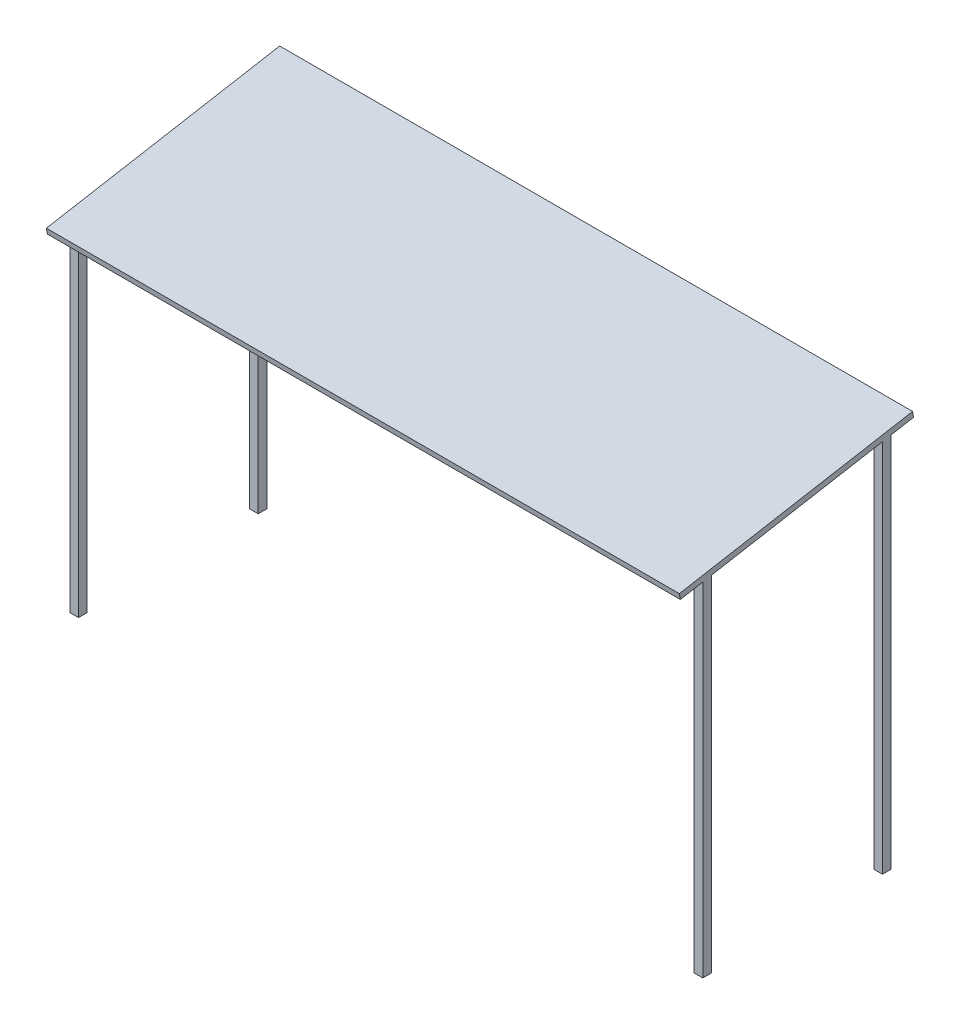
from build123d import *

# Parameters (mm, degrees)
CROQUIS1_W                = 76.2
CROQUIS1_H                = 76.2
SALIENTE_EXTRUIR1_DEPTH   = 3300
SALIENTE_EXTRUIR1_2_DEPTH = 3300
SALIENTE_EXTRUIR1_3_DEPTH = 3300
SALIENTE_EXTRUIR1_4_DEPTH = 3300
CORTAR_EXTRUIR3_START     = -5552.4
CORTAR_EXTRUIR3_DEPTH     = 5552.4
SALIENTE_EXTRUIR3_DEPTH   = 5552.4
CROQUIS7_W                = 5400
CROQUIS7_H                = 76.2
SALIENTE_EXTRUIR4_DEPTH   = 76.2
SALIENTE_EXTRUIR6_DEPTH   = 5400


with BuildPart() as part:
    # Croquis1 → Saliente-Extruir1 (new body)
    with BuildSketch(Plane(origin=(0, 0, 0), x_dir=(1, 0, 0), z_dir=(0, 1, 0))):
        with Locations((38.1, -38.1)):
            Rectangle(CROQUIS1_W, CROQUIS1_H)
    extrude(amount=SALIENTE_EXTRUIR1_DEPTH)


with BuildPart() as body_2:
    # Croquis1 → Saliente-Extruir1 2 (new body)
    with BuildSketch(Plane(origin=(0, 0, 0), x_dir=(1, 0, 0), z_dir=(0, 1, 0))):
        with Locations((5514.3, -38.1)):
            Rectangle(CROQUIS1_W, CROQUIS1_H)
    extrude(amount=SALIENTE_EXTRUIR1_2_DEPTH)


with BuildPart() as body_3:
    # Croquis1 → Saliente-Extruir1 3 (new body)
    with BuildSketch(Plane(origin=(0, 0, 0), x_dir=(1, 0, 0), z_dir=(0, 1, 0))):
        with Locations((5514.3, -1614.3)):
            Rectangle(CROQUIS1_W, CROQUIS1_H)
    extrude(amount=SALIENTE_EXTRUIR1_3_DEPTH)


with BuildPart() as body_4:
    # Croquis1 → Saliente-Extruir1 4 (new body)
    with BuildSketch(Plane(origin=(0, 0, 0), x_dir=(1, 0, 0), z_dir=(0, 1, 0))):
        with Locations((38.1, -1614.3)):
            Rectangle(CROQUIS1_W, CROQUIS1_H)
    extrude(amount=SALIENTE_EXTRUIR1_4_DEPTH)


with BuildPart() as cortar_extruir3_tool:
    # Croquis5 → Cortar-Extruir3 (new body)
    with BuildSketch(Plane(origin=(5552.4, 0, 0), x_dir=(0, 0, -1), z_dir=(1, 0, 0)).offset(CORTAR_EXTRUIR3_START)):
        Polygon((0, 3300), (-2183.717463872, 2914.951692875), (-2226.424126041, 4680.194752027), (0, 4614.378523912), align=None)
    extrude(amount=CORTAR_EXTRUIR3_DEPTH)


with BuildPart() as part_1:
    add(part.part)

    # Cortar-Extruir3: cut by cortar_extruir3_tool
    add(cortar_extruir3_tool.part, mode=Mode.SUBTRACT)



with BuildPart() as body_2_1:
    add(body_2.part)

    # Cortar-Extruir3: cut by cortar_extruir3_tool
    add(cortar_extruir3_tool.part, mode=Mode.SUBTRACT)


with BuildPart() as body_3_1:
    add(body_3.part)

    # Cortar-Extruir3: cut by cortar_extruir3_tool
    add(cortar_extruir3_tool.part, mode=Mode.SUBTRACT)


with BuildPart() as body_4_1:
    add(body_4.part)

    # Cortar-Extruir3: cut by cortar_extruir3_tool
    add(cortar_extruir3_tool.part, mode=Mode.SUBTRACT)


with BuildPart() as part_2:
    add(part_1.part)

    add(body_2_1.part)  # Saliente-Extruir3 merges body 2

    add(body_3_1.part)  # Saliente-Extruir3 merges body 3

    add(body_4_1.part)  # Saliente-Extruir3 merges body 4
    # Croquis6 → Saliente-Extruir3 (add)
    with BuildSketch(Plane.ZY):
        Polygon((0, 3300), (1652.4, 3008.637297077), (1849.361550602, 2973.907661544), (1858.043959486, 3023.148049195), (1661.082408883, 3057.877684728), (8.682408883, 3349.240387651), (-188.279141719, 3383.970023184), (-196.961550602, 3334.729635533), align=None)
    extrude(amount=-SALIENTE_EXTRUIR3_DEPTH)

    # Croquis7 → Saliente-Extruir4 (add)
    with BuildSketch(Plane(origin=(0, 0, 0), x_dir=(-1, 0, 0), z_dir=(0, 0, -1))):
        with Locations((-2776.2, 3261.9)):
            Rectangle(CROQUIS7_W, CROQUIS7_H)
    extrude(amount=-SALIENTE_EXTRUIR4_DEPTH)

    # Croquis9 → Saliente-Extruir6 (add)
    with BuildSketch(Plane(origin=(76.2, 0, 0), x_dir=(0, 0, -1), z_dir=(1, 0, 0))):
        Polygon((-1576.2, 3022.073413007), (-1576.2, 2945.873413007), (-1652.4, 2945.873413007), (-1652.4, 3008.637297077), align=None)
    extrude(amount=SALIENTE_EXTRUIR6_DEPTH)


solid = part_2.part
